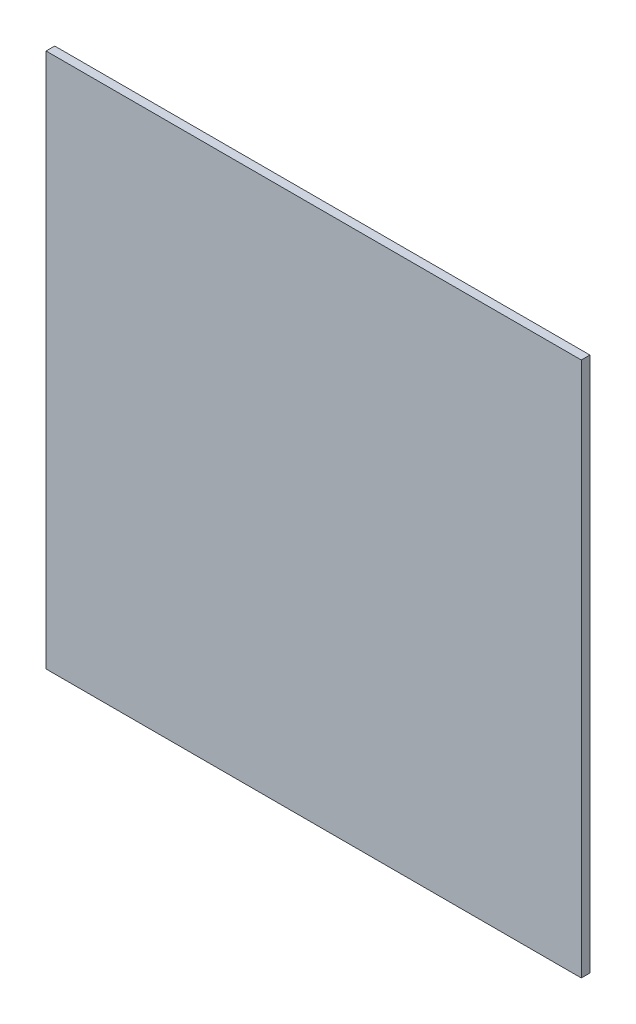
from build123d import *

# Parameters (mm, degrees)
ESQUISSE1_W        = 620
ESQUISSE1_H        = 620
BOSS_EXTRU_1_DEPTH = 10


with BuildPart() as part:
    # Esquisse1 → Boss.-Extru.1 (new body)
    with BuildSketch(Plane.XY):
        with Locations((310, 310)):
            Rectangle(ESQUISSE1_W, ESQUISSE1_H)
    extrude(amount=BOSS_EXTRU_1_DEPTH)


solid = part.part
